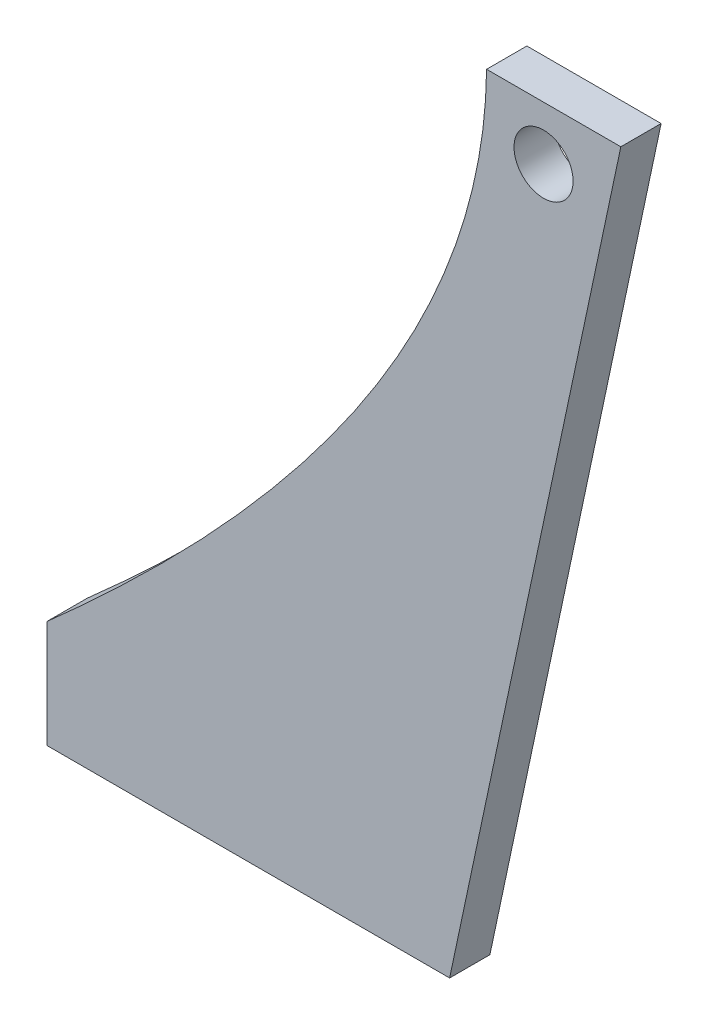
from build123d import *

# Parameters (mm, degrees)
BOSS_EXTRUDE1_DEPTH = 15
SKETCH3_R           = 11
CUT_EXTRUDE1_DEPTH  = 369.675083139


with BuildPart() as part:
    # Sketch2 → Boss-Extrude1 (new body)
    with BuildSketch(Plane.XY):
        with BuildLine():
            Line((0, 0), (150, 0))
            Line((150, 0), (213.766968501, 300))
            Line((213.766968501, 300), (163.766968501, 300))
            add(Edge.make_bspline(
                [(163.766968501, 300), (162.660354377, 183.828545376), (0, 40)],
                knots=[0, 0, 0, 0.298724745, 0.298724745, 0.298724745], degree=2))
            Line((0, 40), (0, 0))
        make_face()
    extrude(amount=-BOSS_EXTRUDE1_DEPTH)

    # Sketch3 → Cut-Extrude1 (cut, through all)
    with BuildSketch(Plane.XY):
        with Locations((184.979662991, 280)):
            Circle(SKETCH3_R)
    extrude(amount=-CUT_EXTRUDE1_DEPTH, mode=Mode.SUBTRACT)


solid = part.part
